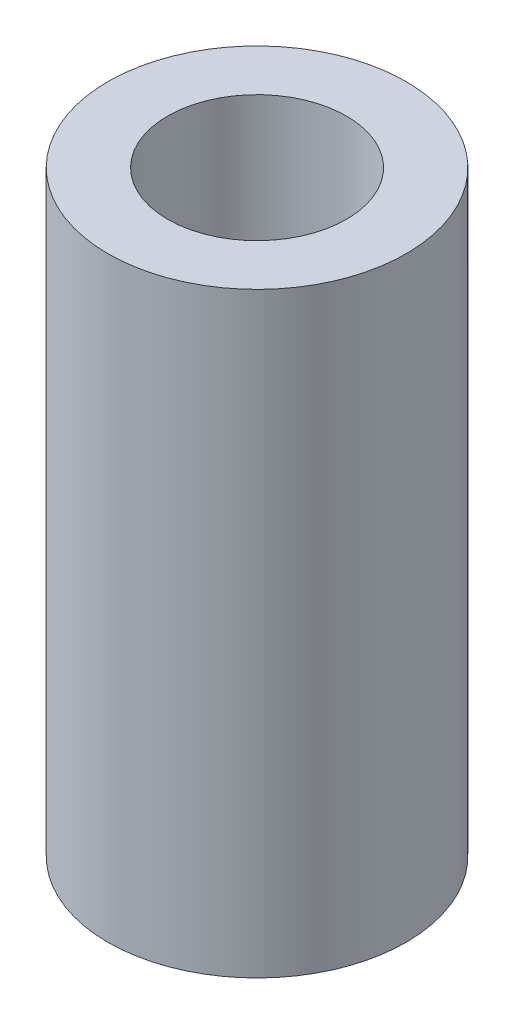
from build123d import *

# Parameters (mm, degrees)
SKETCH1_R           = 2
SKETCH1_R_2         = 1.2
BOSS_EXTRUDE1_DEPTH = 8


with BuildPart() as part:
    # Sketch1 → Boss-Extrude1 (new body)
    with BuildSketch(Plane(origin=(0, 0, 0), x_dir=(1, 0, 0), z_dir=(0, 1, 0))):
        with Locations(Location((-4.18712532, 0.837425064, 0), (0, 0, 270))):
            Circle(SKETCH1_R)
        with Locations(Location((-4.18712532, 0.837425064, 0), (0, 0, 270))):
            Circle(SKETCH1_R_2, mode=Mode.SUBTRACT)
    extrude(amount=BOSS_EXTRUDE1_DEPTH)


solid = part.part
